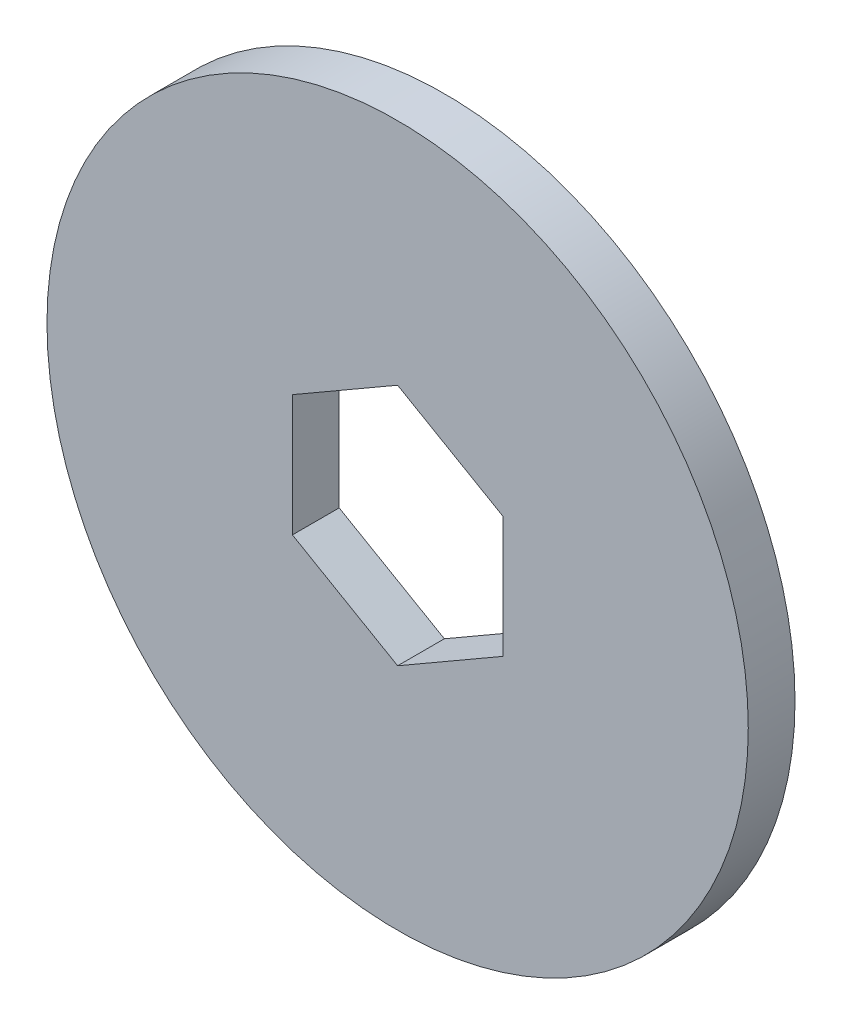
from build123d import *

# Parameters (mm, degrees)
MODEL_R             = 25
BOSS_EXTRUDE1_DEPTH = 6
BOSS_EXTRUDE2_START = -6
SKETCH2_R           = 45
SKETCH2_R_2         = 25
BOSS_EXTRUDE2_DEPTH = 6


with BuildPart() as part:
    # Model → Boss-Extrude1 (new body)
    with BuildSketch(Plane.XY):
        with Locations((642.3, -192)):
            Circle(MODEL_R)
        Polygon((628.8, -184.205771366), (628.8, -199.794228634), (642.3, -207.588457268), (655.8, -199.794228634), (655.8, -184.205771366), (642.3, -176.411542732), align=None, mode=Mode.SUBTRACT)
    extrude(amount=BOSS_EXTRUDE1_DEPTH)

    # Sketch2 → Boss-Extrude2 (add)
    with BuildSketch(Plane.XY.offset(6).offset(BOSS_EXTRUDE2_START)):
        with Locations((642.3, -192)):
            Circle(SKETCH2_R)
        with Locations((642.3, -192)):
            Circle(SKETCH2_R_2, mode=Mode.SUBTRACT)
    extrude(amount=BOSS_EXTRUDE2_DEPTH)


solid = part.part
